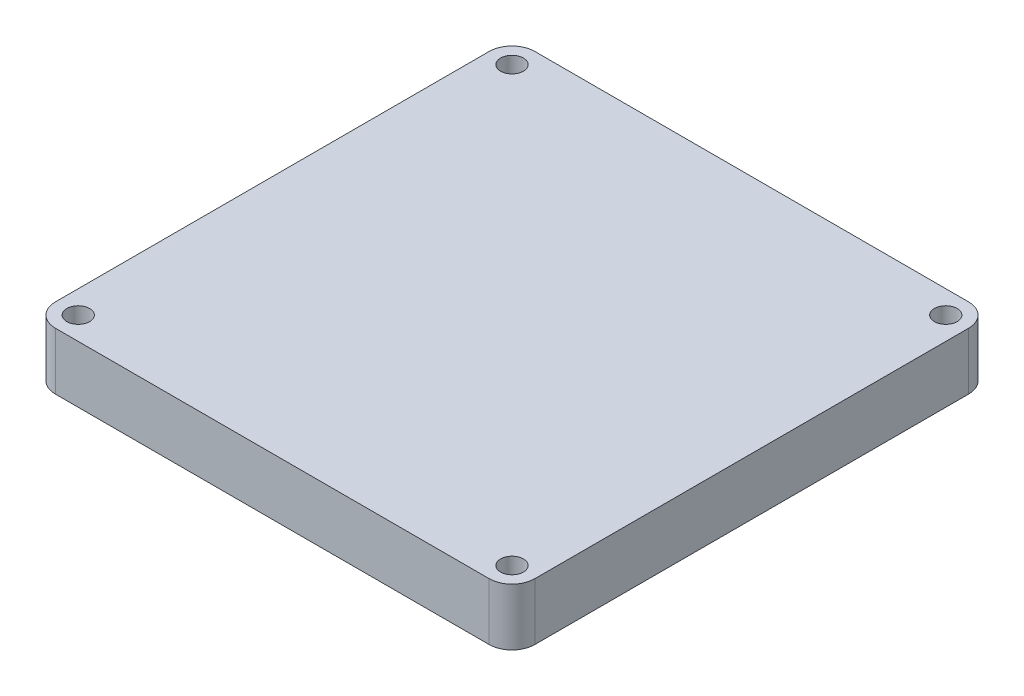
from build123d import *

# Parameters (mm, degrees)
BOSS_EXTRUDE1_DEPTH   = 5
F_2_0MM_DOWEL_HOLE1_D = 2
MIRROR2_COPY_1_D      = 2


with BuildPart() as part:
    # Sketch1 → Boss-Extrude1 (new body)
    with BuildSketch(Plane(origin=(0, 0, 0), x_dir=(1, 0, 0), z_dir=(0, 1, 0))):
        with BuildLine():
            Line((-19, -21), (19, -21))
            ThreePointArc((19, -21), (20.414213562, -20.414213562), (21, -19))
            Line((21, -19), (21, 19))
            ThreePointArc((21, 19), (20.414213562, 20.414213562), (19, 21))
            Line((19, 21), (-19, 21))
            ThreePointArc((-19, 21), (-20.414213562, 20.414213562), (-21, 19))
            Line((-21, 19), (-21, -19))
            ThreePointArc((-21, -19), (-20.414213562, -20.414213562), (-19, -21))
        make_face()
    extrude(amount=BOSS_EXTRUDE1_DEPTH)

    # Ø2.0mm Dowel Hole1 (through all)
    with Locations(Plane(origin=(0, 5, 0), x_dir=(1, 0, 0), z_dir=(0, 1, 0))):
        with Locations((-19, 19)):
            f_2_0mm_dowel_hole1 = Hole(F_2_0MM_DOWEL_HOLE1_D / 2)

    # Mirror1: Ø2.0mm Dowel Hole1 across plane
    add(f_2_0mm_dowel_hole1.mirror(Plane(origin=(0, 0, 0), x_dir=(0, 0, 1), z_dir=(1, 0, 0))), mode=Mode.SUBTRACT)

    # Mirror2: Ø2.0mm Dowel Hole1 across plane
    add(f_2_0mm_dowel_hole1.mirror(Plane.XY), mode=Mode.SUBTRACT)

    # Mirror2 copy 1 (through all)
    with Locations(Plane(origin=(0, 5, 0), x_dir=(-1, 0, 0), z_dir=(0, 1, 0))):
        with Locations((-19, 19)):
            Hole(MIRROR2_COPY_1_D / 2)


solid = part.part
